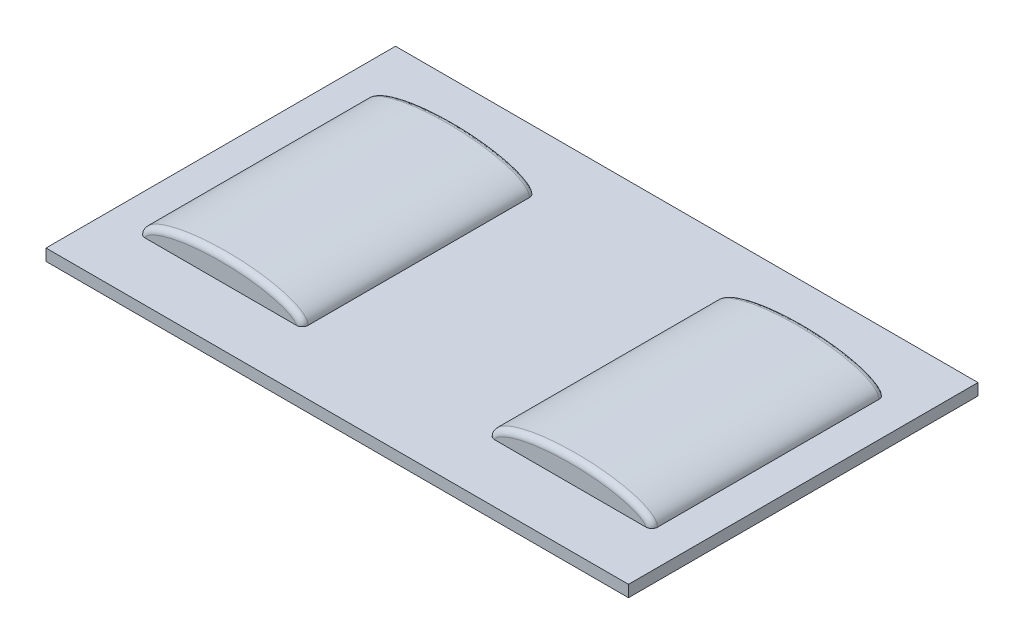
from build123d import *

# Parameters (mm, degrees)
SKETCH_1_W      = 50
SKETCH_1_H      = 30
EXTRUDE_1_DEPTH = 1
EXTRUDE_2_DEPTH = 10
FILLET_2_R      = 0.5


with BuildPart() as part:
    # Эскиз1 → Бобышка-Вытянуть1 (new body)
    with BuildSketch(Plane(origin=(0, 0, 0), x_dir=(1, 0, 0), z_dir=(0, 1, 0))):
        Rectangle(SKETCH_1_W, SKETCH_1_H)
    extrude(amount=EXTRUDE_1_DEPTH)

    # Эскиз2 → Бобышка-Вытянуть2 (add, symmetric)
    with BuildSketch(Plane.XY):
        with BuildLine():
            Line((-22, 1), (-8, 1))
            add(Edge.make_bspline(
                [(-8, 1), (-8, 3), (-15, 3), (-22, 3), (-22, 1)],
                knots=[0, 0, 0, 1.570796327, 1.570796327, 3.141592654, 3.141592654, 3.141592654], degree=2, weights=[1, 0.707106781, 1, 0.707106781, 1]))
        make_face()
        with BuildLine():
            Line((8, 1), (22, 1))
            add(Edge.make_bspline(
                [(22, 1), (22, 3), (15, 3), (8, 3), (8, 1)],
                knots=[3.141592654, 3.141592654, 3.141592654, 4.71238898, 4.71238898, 6.283185307, 6.283185307, 6.283185307], degree=2, weights=[1, 0.707106781, 1, 0.707106781, 1]))
        make_face()
    extrude(amount=EXTRUDE_2_DEPTH, both=True)

    # Скругление2
    fillet_2_edges = [part.edges().sort_by_distance(p)[0] for p in [
        (-15, 3, -10),
        (-15, 3, 10),
        (15, 3, -10),
        (15, 3, 10),
    ]]
    fillet(fillet_2_edges, radius=FILLET_2_R)


solid = part.part
